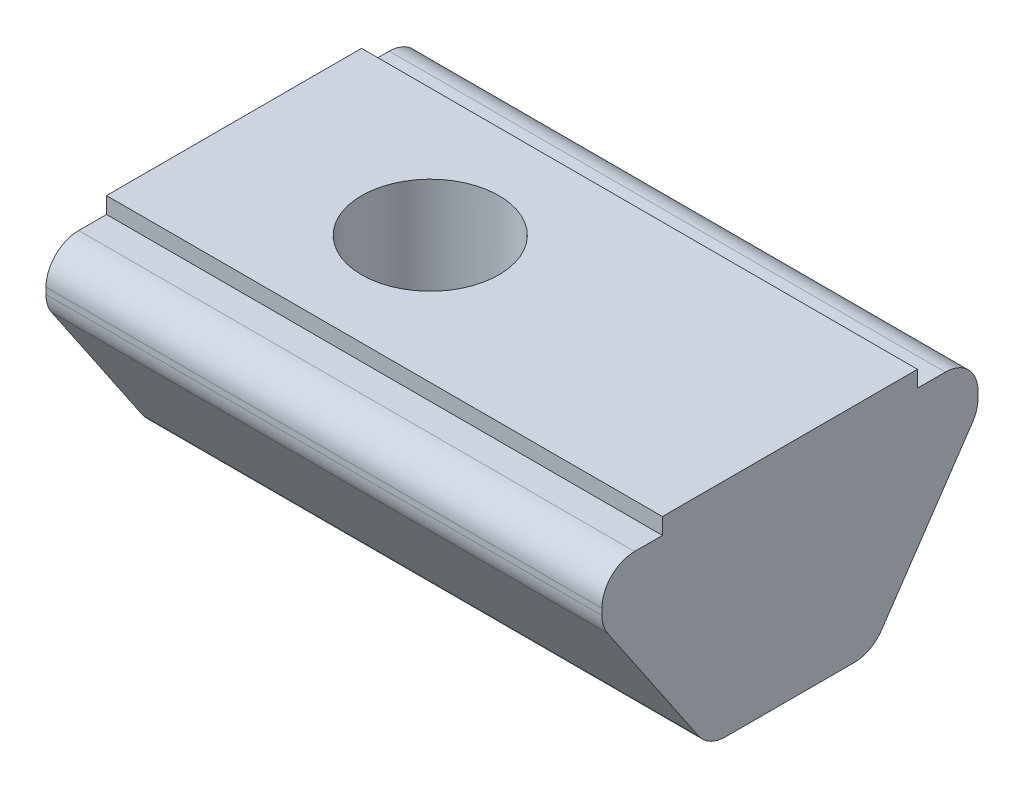
from build123d import *

# Parameters (mm, degrees)
BOSS_EXTRUDE1_DEPTH = 17
FILLET1_R           = 1
SKETCH2_W           = 2.35
SKETCH2_H           = 0.2
TAPPED_HOLE1_D      = 4.2


with BuildPart() as part:
    # Sketch1 → Boss-Extrude1 (new body)
    with BuildSketch(Plane(origin=(-6, 0, 0), x_dir=(0, 0, -1), z_dir=(1, 0, 0))):
        Polygon((3.9, 0), (-3.9, 0), (-3.9, -0.5), (-5.75, -0.5), (-5.75, -2), (-2.5, -6.8), (2.5, -6.8), (5.75, -2), (5.75, -0.5), (3.9, -0.5), align=None)
    extrude(amount=BOSS_EXTRUDE1_DEPTH)

    # Fillet1
    fillet1_edges = [part.edges().sort_by_distance(p)[0] for p in [
        (2.5, -0.5, 5.75),
        (2.5, -0.5, -5.75),
        (2.5, -2, -5.75),
        (2.5, -6.8, -2.5),
        (2.5, -6.8, 2.5),
        (2.5, -2, 5.75),
    ]]
    fillet(fillet1_edges, radius=FILLET1_R)

    # Sketch2 → Cut-Revolve1 (revolve, cut)
    with BuildSketch(Plane(origin=(7.5, 0, 0), x_dir=(0, 0, -1), z_dir=(1, 0, 0)), mode=Mode.PRIVATE) as cut_revolve1_sk:
        with Locations((1.175, -6.7)):
            Rectangle(SKETCH2_W, SKETCH2_H)
    revolve(cut_revolve1_sk.sketch.rotate(Axis((7.5, 1.665548573, 0), (0, -1, 0)), 180), axis=Axis((7.5, 1.665548573, 0), (0, -1, 0)), mode=Mode.SUBTRACT)

    # Sketch3 → Revolve1 (revolve)
    with BuildSketch(Plane(origin=(7.5, 0, 0), x_dir=(0, 0, -1), z_dir=(1, 0, 0)), mode=Mode.PRIVATE) as revolve1_sk:
        with BuildLine():
            Line((1.989974874, -6.6), (0, -6.6))
            Line((0, -6.6), (0, -7.8))
            ThreePointArc((0, -7.8), (1.161895004, -7.476784887), (1.989974874, -6.6))
        make_face()
    revolve(revolve1_sk.sketch.rotate(Axis((7.5, 0, 0), (0, -1, 0)), 180), axis=Axis((7.5, 0, 0), (0, -1, 0)))

    # Tapped Hole1 (through all)
    with Locations(Plane(origin=(0, 0, 0), x_dir=(1, 0, 0), z_dir=(0, 1, 0))):
        with Locations((0, 0)):
            Hole(TAPPED_HOLE1_D / 2)


solid = part.part
